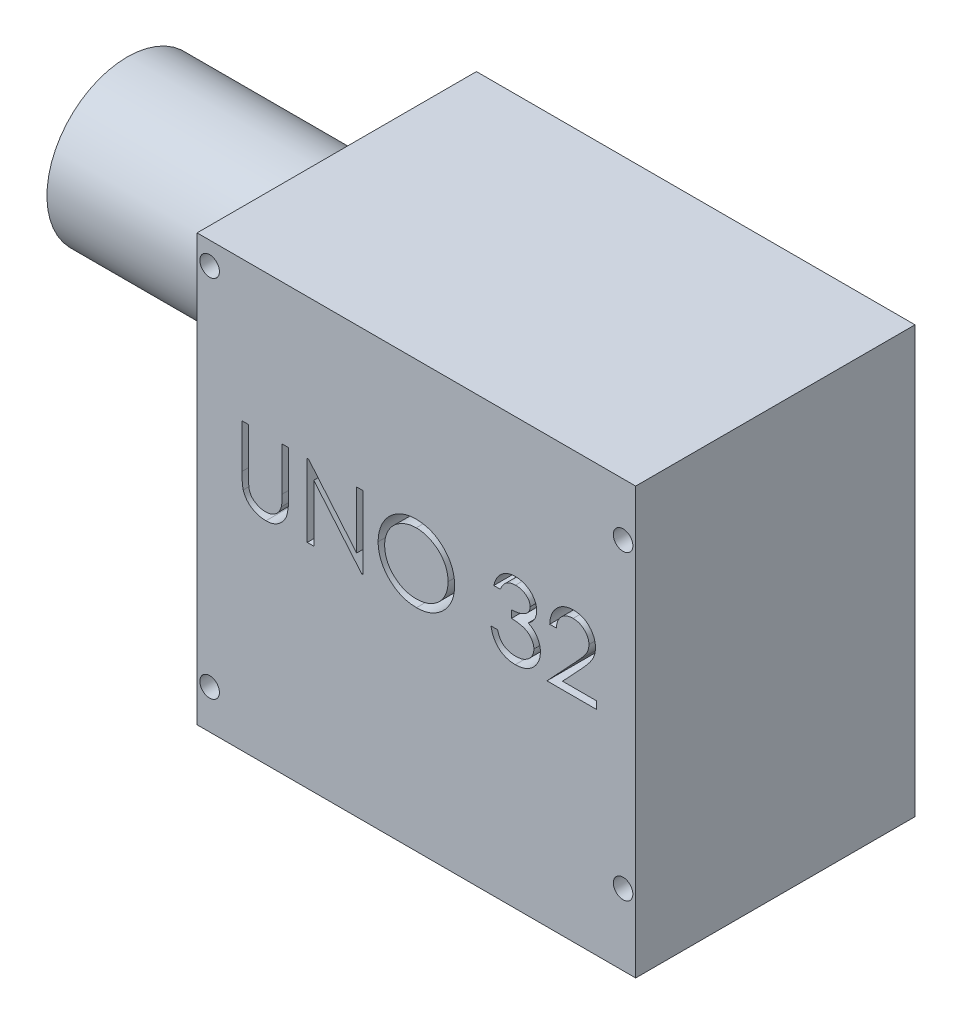
from build123d import *

# Parameters (mm, degrees)
SKETCH1_W           = 79.756
SKETCH1_H           = 77.47
SKETCH1_R           = 1.778
BOSS_EXTRUDE1_DEPTH = 50.8
CUT_EXTRUDE2_DEPTH  = 113.764424224
SKETCH3_R           = 14.599831798
BOSS_EXTRUDE2_DEPTH = 38.1


with BuildPart() as part:
    # Sketch1 → Boss-Extrude1 (new body)
    with BuildSketch(Plane.XY):
        with Locations((-46.331875823, 13.255698024)):
            Rectangle(SKETCH1_W, SKETCH1_H)
        with Locations((-8.739875823, 42.338698024)):
            Circle(SKETCH1_R, mode=Mode.SUBTRACT)
        with Locations((-8.739875823, -12.525301976)):
            Circle(SKETCH1_R, mode=Mode.SUBTRACT)
        with Locations((-83.923875823, 47.926698024)):
            Circle(SKETCH1_R, mode=Mode.SUBTRACT)
        with Locations((-83.923875823, -18.367301976)):
            Circle(SKETCH1_R, mode=Mode.SUBTRACT)
    extrude(amount=BOSS_EXTRUDE1_DEPTH)

    # Sketch2 → Cut-Extrude2 (cut, through all)
    # profile 1 of 5: a face of its own
    with BuildSketch(Plane.XY.offset(50.8)):
        with BuildLine():
            Line((-78.047954883, 26.484864691), (-76.860721977, 26.484864691))
            Line((-76.860721977, 26.484864691), (-76.860721977, 18.558494999))
            add(Edge.make_bspline(
                [(-76.860721977, 18.558494999), (-76.860898658, 18.446308885), (-76.861233941, 18.2334164), (-76.85899438, 17.930399312), (-76.852722362, 17.661006386), (-76.848768128, 17.424199209), (-76.839971362, 17.22106442), (-76.832797196, 17.05050149), (-76.823572473, 16.913318046), (-76.812485987, 16.833259188), (-76.807720508, 16.798846228)],
                knots=[0, 0, 0, 0, 1.528628734, 2.90083645, 4.128790002, 5.200304208, 6.127813768, 6.898992206, 7.526736466, 8, 8, 8, 8], degree=3))
            add(Edge.make_bspline(
                [(-76.807720508, 16.798846228), (-76.788150947, 16.674693283), (-76.750114498, 16.433382967), (-76.653177297, 16.089771307), (-76.517795671, 15.780089902), (-76.357371075, 15.494675201), (-76.145959121, 15.241471369), (-75.892701711, 15.008216015), (-75.585869074, 14.804215444), (-75.244705475, 14.617681126), (-74.87699044, 14.467756558), (-74.501239523, 14.354388782), (-74.123100882, 14.285298893), (-73.869946924, 14.27729888), (-73.744235599, 14.273326229)],
                knots=[0, 0, 0, 0, 1.035780045, 2.013197591, 2.933192213, 3.817615948, 4.702609284, 5.640816605, 6.646850145, 7.73207398, 8.84249596, 9.914020372, 10.964143139, 12, 12, 12, 12], degree=3))
            add(Edge.make_bspline(
                [(-73.744235599, 14.273326229), (-73.636309259, 14.277385127), (-73.421079933, 14.285479481), (-73.101287769, 14.335604533), (-72.789834977, 14.425942981), (-72.485183598, 14.542509925), (-72.199618865, 14.696526117), (-71.93298145, 14.874442683), (-71.69499277, 15.083126649), (-71.477815219, 15.314071404), (-71.288695075, 15.574647433), (-71.124762486, 15.859180872), (-70.99048293, 16.171953701), (-70.924172584, 16.39176357), (-70.890106492, 16.504688075)],
                knots=[0, 0, 0, 0, 0.994687771, 1.983630487, 2.973142513, 3.978332533, 4.983357753, 5.956394766, 6.925816176, 7.893390482, 8.871859704, 9.88551698, 10.913711441, 12, 12, 12, 12], degree=3))
            add(Edge.make_bspline(
                [(-70.890106492, 16.504688075), (-70.878766733, 16.551362746), (-70.853497179, 16.655372722), (-70.829884837, 16.831212124), (-70.80529172, 17.038680851), (-70.78822772, 17.279269548), (-70.771592155, 17.552172034), (-70.761639767, 17.858809971), (-70.757039672, 18.198069912), (-70.755668827, 18.43482347), (-70.754952746, 18.558494999)],
                knots=[0, 0, 0, 0, 0.558680831, 1.244966039, 2.062412453, 2.990489873, 4.051219941, 5.244515665, 6.560634259, 8, 8, 8, 8], degree=3))
            Line((-70.754952746, 18.558494999), (-70.754952746, 26.484864691))
            Line((-70.754952746, 26.484864691), (-69.56771984, 26.484864691))
            Line((-69.56771984, 26.484864691), (-69.56771984, 18.494893236))
            add(Edge.make_bspline(
                [(-69.56771984, 18.494893236), (-69.568680355, 18.350890435), (-69.570554858, 18.069860213), (-69.586810013, 17.658050016), (-69.61272784, 17.267400355), (-69.649346505, 16.897858716), (-69.697867321, 16.55074746), (-69.751824256, 16.22302408), (-69.820538562, 15.917041042), (-69.900795763, 15.630412559), (-69.992543995, 15.357568505), (-70.11138405, 15.098622253), (-70.245280225, 14.845701755), (-70.40408561, 14.602632415), (-70.582533395, 14.368338002), (-70.784568022, 14.144239415), (-71.003507559, 13.92675552), (-71.242991608, 13.721465062), (-71.499072463, 13.533200122), (-71.770988374, 13.367654976), (-72.056650569, 13.227714517), (-72.355316492, 13.112522779), (-72.667113599, 13.02591105), (-72.99204975, 12.961371026), (-73.330864558, 12.924698652), (-73.561296443, 12.919248499), (-73.677983763, 12.916488622)],
                knots=[0, 0, 0, 0, 1.316592851, 2.569410997, 3.76748051, 4.895814652, 5.963796859, 6.97159953, 7.931736103, 8.829262218, 9.692595152, 10.560224239, 11.431080259, 12.30701507, 13.211635791, 14.121146779, 15.063487852, 16.031507147, 17.00238618, 17.966455255, 18.938106653, 19.907068911, 20.888905087, 21.893141452, 22.933117798, 24, 24, 24, 24], degree=3))
            add(Edge.make_bspline(
                [(-73.677983763, 12.916488622), (-73.805244954, 12.919454848), (-74.054930956, 12.925274573), (-74.422845675, 12.958622467), (-74.775551119, 13.021436041), (-75.11677244, 13.10141559), (-75.441864081, 13.211723169), (-75.755181564, 13.340605962), (-76.051358722, 13.498892035), (-76.335200429, 13.675003967), (-76.599121382, 13.873156617), (-76.841394304, 14.08913287), (-77.062419172, 14.319472987), (-77.258470495, 14.566670798), (-77.432796457, 14.828803738), (-77.582967205, 15.106613365), (-77.711907145, 15.39999212), (-77.778455777, 15.603922371), (-77.812098346, 15.707015966)],
                knots=[0, 0, 0, 0, 1.13879206, 2.234305948, 3.301075583, 4.341971843, 5.366689343, 6.369221514, 7.369726634, 8.367512178, 9.355451585, 10.318319045, 11.268648973, 12.207971039, 13.137398894, 14.081662264, 15.030215811, 16, 16, 16, 16], degree=3))
            add(Edge.make_bspline(
                [(-77.812098346, 15.707015966), (-77.831666771, 15.777442661), (-77.874111121, 15.930199731), (-77.919563883, 16.183014733), (-77.957773805, 16.474112784), (-77.993702552, 16.803513812), (-78.014903078, 17.171473129), (-78.033489825, 17.577831234), (-78.048085825, 18.023079482), (-78.04799975, 18.333226014), (-78.047954883, 18.494893236)],
                knots=[0, 0, 0, 0, 0.625038921, 1.35572334, 2.194682327, 3.136881307, 4.189498639, 5.346923369, 6.617055217, 8, 8, 8, 8], degree=3))
            Line((-78.047954883, 18.494893236), (-78.047954883, 26.484864691))
        make_face()
    # profile 2 of 5: a face of its own
    with BuildSketch(Plane.XY.offset(50.8)):
        Polygon((-66.175625823, 13.255698024), (-66.175625823, 26.484864691), (-65.926518919, 26.484864691), (-57.186576678, 16.072726102), (-57.186576678, 26.484864691), (-55.999343772, 26.484864691), (-55.999343772, 13.255698024), (-56.269651264, 13.255698024), (-64.988392917, 23.643985951), (-64.988392917, 13.255698024), align=None)
    # profile 3 of 5: a face of its own
    with BuildSketch(Plane.XY.offset(50.8)):
        with BuildLine():
            add(Edge.make_bspline(
                [(-46.416678174, 26.824074092), (-46.171718964, 26.817869691), (-45.690598866, 26.805683735), (-44.983500294, 26.7124026), (-44.308453356, 26.551024191), (-43.659959082, 26.336095656), (-43.045774319, 26.04938414), (-42.461276124, 25.702836109), (-41.907855202, 25.292820923), (-41.392970814, 24.822508071), (-40.921797222, 24.31079085), (-40.506681521, 23.764698749), (-40.158783565, 23.187533633), (-39.873087287, 22.581029899), (-39.648952661, 21.946559186), (-39.494288418, 21.280738997), (-39.395492434, 20.587883353), (-39.383942323, 20.115311573), (-39.378083088, 19.875581504)],
                knots=[0, 0, 0, 0, 1.065120563, 2.091984664, 3.0946048, 4.079830382, 5.057816894, 6.036188127, 7.030412546, 8.04752943, 9.064399622, 10.05169764, 11.02544977, 11.989514704, 12.962713494, 13.945757189, 14.957906945, 16, 16, 16, 16], degree=3))
            add(Edge.make_bspline(
                [(-39.378083088, 19.875581504), (-39.383941464, 19.637617347), (-39.395489002, 19.168562424), (-39.49440075, 18.480103573), (-39.649525958, 17.818302428), (-39.871005893, 17.1842638), (-40.155340291, 16.577318842), (-40.505554777, 15.999064582), (-40.918082568, 15.449311448), (-41.387554891, 14.934082029), (-41.899338592, 14.461621351), (-42.448274422, 14.049933934), (-43.02201703, 13.695679058), (-43.627949558, 13.413014576), (-44.258036006, 13.187090949), (-44.917915621, 13.03305571), (-45.604496346, 12.933696945), (-46.072699247, 12.922287674), (-46.310675236, 12.916488622)],
                knots=[0, 0, 0, 0, 1.043624062, 2.057103931, 3.04512605, 4.022047818, 4.998200453, 5.980619268, 6.982898556, 8.009068085, 9.034988726, 10.034168286, 11.015286542, 11.987931943, 12.962482838, 13.94673481, 14.956375938, 16, 16, 16, 16], degree=3))
            add(Edge.make_bspline(
                [(-46.310675236, 12.916488622), (-46.55040406, 12.922344936), (-47.022973389, 12.933889288), (-47.716699683, 13.032848765), (-48.382987584, 13.187597145), (-49.019931709, 13.408748883), (-49.627887246, 13.694564011), (-50.208043214, 14.043074611), (-50.758070943, 14.456607555), (-51.273410282, 14.925927644), (-51.744932549, 15.436843927), (-52.156017094, 15.984282926), (-52.504606064, 16.557504444), (-52.789461517, 17.158099252), (-53.014978968, 17.783163932), (-53.168833489, 18.436867998), (-53.268377117, 19.115484583), (-53.279848114, 19.577533633), (-53.285668558, 19.811979741)],
                knots=[0, 0, 0, 0, 1.053102029, 2.075944431, 3.073151272, 4.055350789, 5.033113405, 6.020478099, 7.024410459, 8.052272461, 9.079885166, 10.07527673, 11.055994387, 12.023226415, 12.992069828, 13.970394897, 14.97016774, 16, 16, 16, 16], degree=3))
            add(Edge.make_bspline(
                [(-53.285668558, 19.811979741), (-53.283647763, 19.969341318), (-53.279631667, 20.282079285), (-53.231282115, 20.74648578), (-53.161123304, 21.203423682), (-53.060574408, 21.651593635), (-52.929070191, 22.089898547), (-52.773903302, 22.521361252), (-52.584386624, 22.941609255), (-52.37014727, 23.352633385), (-52.131032698, 23.748026362), (-51.866919002, 24.121767644), (-51.587082937, 24.476993435), (-51.280304633, 24.804498479), (-50.956694855, 25.113810216), (-50.611003962, 25.400175248), (-50.245341312, 25.666175807), (-49.858133508, 25.905889596), (-49.458921576, 26.122693468), (-49.047393279, 26.308740345), (-48.629137785, 26.468420399), (-48.20219611, 26.597842565), (-47.767702001, 26.700017225), (-47.324707161, 26.76959264), (-46.873564508, 26.818065508), (-46.569628868, 26.822062614), (-46.416678174, 26.824074092)],
                knots=[0, 0, 0, 0, 1.037015668, 2.060948919, 3.074880161, 4.083647147, 5.086022904, 6.090072063, 7.104153813, 8.122640571, 9.144368836, 10.147691507, 11.138137339, 12.123020368, 13.103399296, 14.087645067, 15.080126199, 16.082011238, 17.087798457, 18.072939717, 19.057185487, 20.037253025, 21.01195951, 21.997135196, 22.992090687, 24, 24, 24, 24], degree=3))
        make_face()
        with BuildLine():
            add(Edge.make_bspline(
                [(-46.358376558, 25.467236486), (-46.483919964, 25.465706097), (-46.733806574, 25.46265995), (-47.10529872, 25.422535073), (-47.471905137, 25.365347695), (-47.833701535, 25.283774685), (-48.189174117, 25.172634366), (-48.541636314, 25.04472379), (-48.887874048, 24.888917883), (-49.226744284, 24.712884149), (-49.555262574, 24.518041502), (-49.865251059, 24.302701787), (-50.157512243, 24.07191499), (-50.431330543, 23.825142509), (-50.685901937, 23.561127645), (-50.92623697, 23.283872902), (-51.142702353, 22.985453551), (-51.341085336, 22.673961835), (-51.51861259, 22.349803478), (-51.676475687, 22.0163912), (-51.805607506, 21.671005301), (-51.910920654, 21.31739286), (-51.998232439, 20.95611392), (-52.053545188, 20.584427825), (-52.094110951, 20.204202253), (-52.096982986, 19.947247031), (-52.098435652, 19.817279888)],
                knots=[0, 0, 0, 0, 1.008559885, 2.007477868, 2.99961109, 3.989939068, 4.984837346, 5.991145699, 7.001802488, 8.033829008, 9.059044045, 10.069351652, 11.065060232, 12.050310815, 13.029377138, 14.011219647, 14.996725999, 15.989392538, 16.977580475, 17.965360261, 18.951710183, 19.937753436, 20.929683414, 21.935841486, 22.955955122, 24, 24, 24, 24], degree=3))
            add(Edge.make_bspline(
                [(-52.098435652, 19.817279888), (-52.093616978, 19.626166732), (-52.084137154, 19.250188032), (-52.001142767, 18.699219154), (-51.873303756, 18.169718786), (-51.684854782, 17.664584189), (-51.449184304, 17.179473358), (-51.158040998, 16.718689748), (-50.813103383, 16.282108824), (-50.421279935, 15.872778492), (-49.992947085, 15.499164886), (-49.538118017, 15.17121986), (-49.061665393, 14.893746594), (-48.56234674, 14.66769766), (-48.042827768, 14.488575734), (-47.499760834, 14.365814241), (-46.936763561, 14.28502011), (-46.553001859, 14.277261181), (-46.358376558, 14.273326229)],
                knots=[0, 0, 0, 0, 1.032063989, 2.030389145, 3.003944642, 3.970395727, 4.937377036, 5.913328081, 6.909231446, 7.93887556, 8.970685674, 9.976071282, 10.964166581, 11.944589148, 12.933237628, 13.927779006, 14.949070134, 16, 16, 16, 16], degree=3))
            add(Edge.make_bspline(
                [(-46.358376558, 14.273326229), (-46.227560882, 14.275123522), (-45.968114108, 14.278688095), (-45.582217342, 14.314590832), (-45.203272732, 14.372163671), (-44.831811793, 14.455056328), (-44.468256107, 14.558800233), (-44.11108825, 14.682049681), (-43.764112569, 14.835814945), (-43.422951873, 15.0057075), (-43.09639465, 15.199383096), (-42.784656775, 15.407414197), (-42.49559578, 15.637861067), (-42.221982325, 15.880967085), (-41.966365763, 16.14163401), (-41.730474662, 16.419522943), (-41.515103329, 16.716387928), (-41.316795676, 17.027407169), (-41.139890487, 17.352452529), (-40.985755202, 17.687073633), (-40.854990121, 18.030446517), (-40.749427022, 18.383066445), (-40.666705188, 18.744263701), (-40.609706681, 19.114521913), (-40.569836095, 19.49310038), (-40.566830892, 19.749156026), (-40.565315994, 19.878231578)],
                knots=[0, 0, 0, 0, 1.047197238, 2.076906641, 3.100256066, 4.114471768, 5.12198147, 6.126382909, 7.136867548, 8.15857795, 9.17633901, 10.174870724, 11.156907918, 12.133735059, 13.104061851, 14.077631395, 15.04955518, 16.038496417, 17.029181396, 18.010275684, 18.986308667, 19.968651475, 20.955262928, 21.950658345, 22.966943676, 24, 24, 24, 24], degree=3))
            add(Edge.make_bspline(
                [(-40.565315994, 19.878231578), (-40.566832106, 20.006424109), (-40.569839592, 20.260717608), (-40.609687636, 20.63665582), (-40.666765406, 21.004249804), (-40.749023261, 21.36205644), (-40.855046164, 21.710166937), (-40.985778038, 22.048254346), (-41.139936759, 22.377578179), (-41.316860702, 22.69732448), (-41.515735987, 23.004145662), (-41.733050538, 23.297464305), (-41.972556467, 23.571771988), (-42.227410787, 23.833840623), (-42.503979312, 24.078080861), (-42.801009233, 24.304573721), (-43.114894563, 24.518785205), (-43.447238578, 24.712027656), (-43.790229117, 24.890486214), (-44.142177708, 25.043381374), (-44.499097222, 25.173299802), (-44.860080027, 25.28411095), (-45.228164499, 25.365028206), (-45.600863495, 25.422586609), (-45.977661377, 25.462645984), (-46.231068785, 25.465701463), (-46.358376558, 25.467236486)],
                knots=[0, 0, 0, 0, 1.02996197, 2.043119294, 3.035359645, 4.018872909, 4.991431989, 5.957985074, 6.929999688, 7.912076566, 8.892894881, 9.867085534, 10.843653904, 11.817741046, 12.803660682, 13.806313499, 14.818574707, 15.856120519, 16.894564902, 17.924820532, 18.937903209, 19.946497019, 20.957711757, 21.963978472, 22.977135795, 24, 24, 24, 24], degree=3))
        make_face(mode=Mode.SUBTRACT)
    # profile 4 of 5: a face of its own
    with BuildSketch(Plane.XY.offset(50.8)):
        with BuildLine():
            Line((-31.067452746, 23.431980075), (-32.254685652, 23.431980075))
            add(Edge.make_bspline(
                [(-32.254685652, 23.431980075), (-32.222521577, 23.565150476), (-32.15964344, 23.825487717), (-32.028494874, 24.197443733), (-31.885622689, 24.549428471), (-31.714062681, 24.874851131), (-31.526931377, 25.180251745), (-31.312532995, 25.458703495), (-31.080759044, 25.717288216), (-30.824396885, 25.946769799), (-30.555547479, 26.154572525), (-30.270422577, 26.331749081), (-29.974758663, 26.484164778), (-29.666507238, 26.609729345), (-29.344750577, 26.704319866), (-29.012397537, 26.772948268), (-28.668577164, 26.817515872), (-28.435185974, 26.821865483), (-28.316676504, 26.824074092)],
                knots=[0, 0, 0, 0, 1.162005537, 2.271625781, 3.343758855, 4.383309926, 5.390229558, 6.379919256, 7.361854164, 8.333198761, 9.295911338, 10.242430842, 11.177959212, 12.116337295, 13.062827104, 14.020064771, 14.994644689, 16, 16, 16, 16], degree=3))
            add(Edge.make_bspline(
                [(-28.316676504, 26.824074092), (-28.144006616, 26.81886093), (-27.802433271, 26.808548321), (-27.300620564, 26.714377683), (-26.81670967, 26.565360069), (-26.355997335, 26.359462351), (-25.928058617, 26.105510304), (-25.547299815, 25.803262638), (-25.218881932, 25.458550992), (-24.943358541, 25.077805883), (-24.727628633, 24.67089369), (-24.568552162, 24.252095477), (-24.471708308, 23.822404692), (-24.459157394, 23.532280452), (-24.452869413, 23.386928827)],
                knots=[0, 0, 0, 0, 1.083050992, 2.142477498, 3.193116406, 4.255571735, 5.30263384, 6.308962982, 7.297363603, 8.282367274, 9.249857812, 10.179914175, 11.08814088, 12, 12, 12, 12], degree=3))
            add(Edge.make_bspline(
                [(-24.452869413, 23.386928827), (-24.45726751, 23.247051954), (-24.465873904, 22.97333462), (-24.538950708, 22.573732533), (-24.661930034, 22.197111008), (-24.832283006, 21.841884591), (-25.052800175, 21.510305584), (-25.319926143, 21.20162796), (-25.635546322, 20.914482631), (-25.874725642, 20.749989385), (-25.997862235, 20.665303393)],
                knots=[0, 0, 0, 0, 1.024540389, 2.004866551, 2.965041327, 3.920577974, 4.882998113, 5.874504559, 6.905732034, 8, 8, 8, 8], degree=3))
            add(Edge.make_bspline(
                [(-25.997862235, 20.665303393), (-25.857135067, 20.597350185), (-25.578313846, 20.462715226), (-25.198256785, 20.198677095), (-24.853248149, 19.893815306), (-24.660844211, 19.655907064), (-24.564172498, 19.536372102)],
                knots=[0, 0, 0, 0, 1.015518401, 2.012035669, 3.001164323, 4, 4, 4, 4], degree=3))
            add(Edge.make_bspline(
                [(-24.564172498, 19.536372102), (-24.500516234, 19.449219291), (-24.374246121, 19.276340857), (-24.218385621, 18.998390676), (-24.076988076, 18.717359749), (-23.966807187, 18.425715565), (-23.881483345, 18.1268384), (-23.820492986, 17.820215058), (-23.78260412, 17.505595152), (-23.777178075, 17.292747384), (-23.77445061, 17.185756952)],
                knots=[0, 0, 0, 0, 1.025084078, 2.033381695, 3.024893161, 4.013698104, 4.991890475, 5.976764909, 6.982997093, 8, 8, 8, 8], degree=3))
            add(Edge.make_bspline(
                [(-23.77445061, 17.185756952), (-23.781233444, 17.000511874), (-23.794767191, 16.630893487), (-23.915734972, 16.084813438), (-24.103261209, 15.551014664), (-24.369571652, 15.040463932), (-24.69413039, 14.562776183), (-25.080260753, 14.135374658), (-25.523575451, 13.767987076), (-26.017989659, 13.461031749), (-26.553646663, 13.21565746), (-27.126566311, 13.045351054), (-27.728493599, 12.934430163), (-28.141271182, 12.922535747), (-28.351127459, 12.916488622)],
                knots=[0, 0, 0, 0, 0.955779014, 1.907060117, 2.875433937, 3.871313158, 4.872415639, 5.851225146, 6.836215519, 7.83643374, 8.849228613, 9.86973379, 10.916971861, 12, 12, 12, 12], degree=3))
            add(Edge.make_bspline(
                [(-28.351127459, 12.916488622), (-28.492563505, 12.919770262), (-28.77086248, 12.926227434), (-29.179997131, 12.970369766), (-29.570528554, 13.050992107), (-29.942984772, 13.159483767), (-30.297696666, 13.297035887), (-30.633581825, 13.468329776), (-30.952706721, 13.66983456), (-31.252059899, 13.903928776), (-31.531605676, 14.165795745), (-31.78391508, 14.460084265), (-32.013194654, 14.781354214), (-32.213305223, 15.133337194), (-32.393361562, 15.511484446), (-32.541456249, 15.920637997), (-32.671803488, 16.357140104), (-32.732406165, 16.6613268), (-32.763499755, 16.817396742)],
                knots=[0, 0, 0, 0, 1.048658725, 2.063410685, 3.046034179, 4.001477787, 4.936774919, 5.862367409, 6.792675028, 7.730719943, 8.675894397, 9.627829632, 10.600096036, 11.597688215, 12.626045268, 13.701542398, 14.82072376, 16, 16, 16, 16], degree=3))
            Line((-32.763499755, 16.817396742), (-31.576266849, 16.817396742))
            add(Edge.make_bspline(
                [(-31.576266849, 16.817396742), (-31.545335956, 16.715535888), (-31.485172682, 16.51740768), (-31.382762686, 16.232261287), (-31.266087967, 15.970860312), (-31.14092282, 15.731287202), (-31.009468575, 15.511182585), (-30.862379423, 15.316366592), (-30.710549619, 15.138282346), (-30.596100872, 15.037950033), (-30.54008813, 14.988846061)],
                knots=[0, 0, 0, 0, 1.198163088, 2.33053128, 3.407730985, 4.417276592, 5.372219308, 6.28897303, 7.162600585, 8, 8, 8, 8], degree=3))
            add(Edge.make_bspline(
                [(-30.54008813, 14.988846061), (-30.466017736, 14.931740156), (-30.318105588, 14.817704619), (-30.077076857, 14.67217763), (-29.823587556, 14.546080898), (-29.552145186, 14.449758595), (-29.268607214, 14.368200175), (-28.968390685, 14.314827975), (-28.654144239, 14.278208994), (-28.439575609, 14.274977556), (-28.329926872, 14.273326229)],
                knots=[0, 0, 0, 0, 0.946170439, 1.889420265, 2.845303464, 3.807233317, 4.801018734, 5.828864929, 6.890507805, 8, 8, 8, 8], degree=3))
            add(Edge.make_bspline(
                [(-28.329926872, 14.273326229), (-28.20612643, 14.275654204), (-27.964045354, 14.280206359), (-27.610808237, 14.322069894), (-27.274759254, 14.383039016), (-26.959629445, 14.477204159), (-26.66129092, 14.593548449), (-26.383925756, 14.73963022), (-26.123892855, 14.911022471), (-25.884522781, 15.105828219), (-25.669282321, 15.319088037), (-25.479766899, 15.542143395), (-25.318655827, 15.774053822), (-25.188694088, 16.016102672), (-25.086071472, 16.267287615), (-25.016209375, 16.528313547), (-24.967633708, 16.797044285), (-24.963677763, 16.979716281), (-24.961683516, 17.071803793)],
                knots=[0, 0, 0, 0, 1.217147791, 2.380027433, 3.494444702, 4.572153297, 5.609568379, 6.639424714, 7.649109417, 8.668170816, 9.669597737, 10.625200337, 11.543417969, 12.441394052, 13.322311151, 14.205496177, 15.095365482, 16, 16, 16, 16], degree=3))
            add(Edge.make_bspline(
                [(-24.961683516, 17.071803793), (-24.967467691, 17.19506689), (-24.979007261, 17.440979742), (-25.067108141, 17.802769383), (-25.21201992, 18.151351924), (-25.414889233, 18.480780059), (-25.661842731, 18.786093735), (-25.950483897, 19.058506778), (-26.283209641, 19.283289563), (-26.589445456, 19.438594901), (-26.860700661, 19.54456837), (-27.092836191, 19.615155289), (-27.352719781, 19.674927143), (-27.637208659, 19.730536026), (-27.948446412, 19.777863741), (-28.286094198, 19.817331318), (-28.65022044, 19.848911384), (-28.902297168, 19.863014035), (-29.032196336, 19.870281357)],
                knots=[0, 0, 0, 0, 1.07054697, 2.135767047, 3.216561865, 4.33974944, 5.486079747, 6.621378074, 7.775625952, 8.963672916, 9.598146892, 10.304877434, 11.070270905, 11.915000392, 12.823868403, 13.805723172, 14.86925407, 16, 16, 16, 16], degree=3))
            Line((-29.032196336, 19.870281357), (-29.032196336, 21.227118964))
            add(Edge.make_bspline(
                [(-29.032196336, 21.227118964), (-28.86852824, 21.229896347), (-28.547942644, 21.235336558), (-28.079651671, 21.301134693), (-27.631850759, 21.392153734), (-27.214463966, 21.531570978), (-26.834035793, 21.6934971), (-26.503988488, 21.881926583), (-26.228945997, 22.091381141), (-26.010244923, 22.325093682), (-25.845714803, 22.575748772), (-25.725417086, 22.836993282), (-25.654356329, 23.111116965), (-25.644870386, 23.298195025), (-25.640102319, 23.392228973)],
                knots=[0, 0, 0, 0, 1.321986639, 2.589447074, 3.816329219, 5.01088745, 6.139805852, 7.153945165, 8.075214402, 8.924034688, 9.728124013, 10.488707548, 11.240355623, 12, 12, 12, 12], degree=3))
            add(Edge.make_bspline(
                [(-25.640102319, 23.392228973), (-25.641668694, 23.461314498), (-25.644784922, 23.598756873), (-25.684084157, 23.799556984), (-25.743139312, 23.994218298), (-25.824327574, 24.181912997), (-25.93299648, 24.36133933), (-26.063042917, 24.534027009), (-26.217892582, 24.698990102), (-26.395335194, 24.852752024), (-26.585879814, 24.99929051), (-26.794710809, 25.123696221), (-27.015531585, 25.230077855), (-27.24858662, 25.317804247), (-27.494632226, 25.383796199), (-27.752512369, 25.431178695), (-28.022718792, 25.460803164), (-28.207064327, 25.465068307), (-28.300776064, 25.467236486)],
                knots=[0, 0, 0, 0, 0.884392785, 1.759457502, 2.611959086, 3.489218968, 4.37281399, 5.2945488, 6.255912374, 7.266815255, 8.301784654, 9.332968512, 10.37626691, 11.440494194, 12.520033166, 13.637162961, 14.798855837, 16, 16, 16, 16], degree=3))
            add(Edge.make_bspline(
                [(-28.300776064, 25.467236486), (-28.45140588, 25.461977468), (-28.745620946, 25.451705385), (-29.169766614, 25.361735661), (-29.564068858, 25.218187548), (-29.865462033, 25.046839528), (-30.088024143, 24.877693543), (-30.247064952, 24.729971428), (-30.403246643, 24.565805696), (-30.54629429, 24.375085051), (-30.690960809, 24.170725457), (-30.822664955, 23.942338328), (-30.95064653, 23.695881242), (-31.02776331, 23.521650719), (-31.067452746, 23.431980075)],
                knots=[0, 0, 0, 0, 1.472543308, 2.876219568, 4.221790263, 5.565193594, 6.249813518, 6.953379497, 7.687249741, 8.463570142, 9.283606569, 10.136032583, 11.040678096, 12, 12, 12, 12], degree=3))
        make_face()
    # profile 5 of 5: a face of its own
    with BuildSketch(Plane.XY.offset(50.8)):
        with BuildLine():
            Line((-20.891170695, 22.41435187), (-22.078403601, 22.41435187))
            add(Edge.make_bspline(
                [(-22.078403601, 22.41435187), (-22.07066585, 22.571857904), (-22.055469113, 22.881195563), (-21.984302663, 23.332211519), (-21.882472561, 23.763311503), (-21.738495935, 24.171034094), (-21.559689468, 24.558984348), (-21.345263472, 24.925621312), (-21.091286715, 25.26954634), (-20.803243405, 25.587571135), (-20.490397656, 25.879321775), (-20.152842468, 26.131262722), (-19.798130609, 26.344130111), (-19.427338238, 26.522085995), (-19.036281941, 26.655662198), (-18.628510425, 26.754773753), (-18.202232142, 26.814404584), (-17.911795154, 26.820814249), (-17.764084023, 26.824074092)],
                knots=[0, 0, 0, 0, 1.10065271, 2.161652631, 3.183658789, 4.190468796, 5.17591951, 6.163126047, 7.15150782, 8.156236427, 9.156009102, 10.134482811, 11.092018607, 12.041330605, 13.001268258, 13.972401359, 14.968799086, 16, 16, 16, 16], degree=3))
            add(Edge.make_bspline(
                [(-17.764084023, 26.824074092), (-17.619024041, 26.820678141), (-17.333986357, 26.814005218), (-16.917978148, 26.756700137), (-16.521944922, 26.666947454), (-16.146660804, 26.541023113), (-15.795120024, 26.37174864), (-15.464681731, 26.168406753), (-15.151412, 25.933230605), (-14.869416121, 25.656348631), (-14.610471893, 25.360762237), (-14.387079441, 25.04519784), (-14.195773733, 24.719271671), (-14.036314348, 24.380498409), (-13.918929537, 24.025688272), (-13.829809525, 23.66000688), (-13.779435074, 23.279669053), (-13.77170386, 23.022242488), (-13.767773259, 22.891365091)],
                knots=[0, 0, 0, 0, 1.111607364, 2.184268762, 3.212621178, 4.221274766, 5.211760367, 6.196651075, 7.1921475, 8.207485113, 9.220403448, 10.201281604, 11.166441695, 12.114753415, 13.065576456, 14.026450734, 14.996634279, 16, 16, 16, 16], degree=3))
            add(Edge.make_bspline(
                [(-13.767773259, 22.891365091), (-13.77417339, 22.707109883), (-13.786861337, 22.341832885), (-13.895394844, 21.805050517), (-14.064903978, 21.284980153), (-14.269001131, 20.866419517), (-14.474893999, 20.529138157), (-14.660433091, 20.251443945), (-14.877636394, 19.952444109), (-15.129665241, 19.633139887), (-15.411306156, 19.291030216), (-15.725110167, 18.926321764), (-16.073314994, 18.542782634), (-16.317708732, 18.280823962), (-16.444347445, 18.145083541)],
                knots=[0, 0, 0, 0, 1.184426356, 2.348067706, 3.509069118, 4.696110526, 5.333549288, 6.050745305, 6.844228056, 7.710549037, 8.667450064, 9.695053472, 10.805634456, 12, 12, 12, 12], degree=3))
            Line((-16.444347445, 18.145083541), (-19.754289185, 14.612535631))
            Line((-19.754289185, 14.612535631), (-13.598168558, 14.612535631))
            Line((-13.598168558, 14.612535631), (-13.598168558, 13.255698024))
            Line((-13.598168558, 13.255698024), (-22.587217704, 13.255698024))
            Line((-22.587217704, 13.255698024), (-17.456675503, 18.730749773))
            add(Edge.make_bspline(
                [(-17.456675503, 18.730749773), (-17.331762359, 18.861145158), (-17.091829775, 19.111608006), (-16.752473011, 19.477273362), (-16.447676835, 19.816505257), (-16.175468237, 20.128662747), (-15.941752309, 20.418311827), (-15.734348337, 20.67607157), (-15.568168871, 20.913268451), (-15.387816037, 21.188210652), (-15.21313819, 21.523900065), (-15.06303494, 21.934131569), (-14.971508578, 22.356433982), (-14.960528991, 22.641813706), (-14.955006165, 22.785362153)],
                knots=[0, 0, 0, 0, 1.329631726, 2.553950428, 3.673215718, 4.687767853, 5.603093632, 6.413772471, 7.123043292, 7.734684054, 8.834405432, 9.900288307, 10.943827018, 12, 12, 12, 12], degree=3))
            add(Edge.make_bspline(
                [(-14.955006165, 22.785362153), (-14.95740912, 22.875628153), (-14.962144882, 23.053525105), (-15.003940345, 23.314350445), (-15.06710208, 23.565949592), (-15.157609454, 23.809096456), (-15.277075406, 24.041346391), (-15.422495622, 24.262982105), (-15.590279492, 24.477252896), (-15.784375064, 24.678159707), (-15.997597178, 24.862163073), (-16.222849252, 25.025161848), (-16.461163634, 25.161381106), (-16.711535524, 25.273048491), (-16.973266912, 25.360645914), (-17.246864014, 25.421343521), (-17.531570861, 25.45945291), (-17.725977229, 25.464609155), (-17.825035712, 25.467236486)],
                knots=[0, 0, 0, 0, 0.991446411, 1.95395049, 2.89581595, 3.838931463, 4.798493298, 5.75982156, 6.748411868, 7.785213223, 8.824556874, 9.840280684, 10.836137867, 11.835679398, 12.848801643, 13.863922112, 14.911575587, 16, 16, 16, 16], degree=3))
            add(Edge.make_bspline(
                [(-17.825035712, 25.467236486), (-17.928490943, 25.464533834), (-18.131659935, 25.459226272), (-18.429955089, 25.422098941), (-18.714517403, 25.358047699), (-18.986062691, 25.270445388), (-19.245050411, 25.159099087), (-19.490221054, 25.020413029), (-19.721024237, 24.854921849), (-19.937893834, 24.667292365), (-20.137707088, 24.458393992), (-20.31326522, 24.225523), (-20.466663131, 23.972931282), (-20.600501602, 23.701300391), (-20.709191264, 23.408165568), (-20.792244541, 23.094567398), (-20.857962682, 22.761867533), (-20.879917507, 22.532114385), (-20.891170695, 22.41435187)],
                knots=[0, 0, 0, 0, 1.031018746, 2.02475058, 2.990194455, 3.934040569, 4.864654155, 5.795059489, 6.735614925, 7.690564532, 8.649604399, 9.611025574, 10.590972636, 11.591080095, 12.624614302, 13.701020113, 14.821632451, 16, 16, 16, 16], degree=3))
        make_face()
    extrude(amount=-CUT_EXTRUDE2_DEPTH, mode=Mode.SUBTRACT)


with BuildPart() as cut_extrude2_piece_1:
    # of the separate pieces the step leaves, piece 1, a body of its own (cut_extrude2_pieces)
    add(part.part.solids().sort_by_distance((-86.209875823, 51.990698024, 0))[0])

    # Sketch3 → Boss-Extrude2 (add)
    with BuildSketch(Plane.ZY.offset(86.209875823)):
        with Locations(Location((25.4, 33.352132318, 0), (0, 0, 90))):
            Circle(SKETCH3_R)
    extrude(amount=BOSS_EXTRUDE2_DEPTH)


with BuildPart() as cut_extrude2_piece_2:
    # of the separate pieces the step leaves, piece 2, a body of its own (cut_extrude2_pieces)
    add(part.part.solids().sort_by_distance((-46.358376558, 14.273326229, 0))[0])


solid = Compound([cut_extrude2_piece_1.part, cut_extrude2_piece_2.part])
